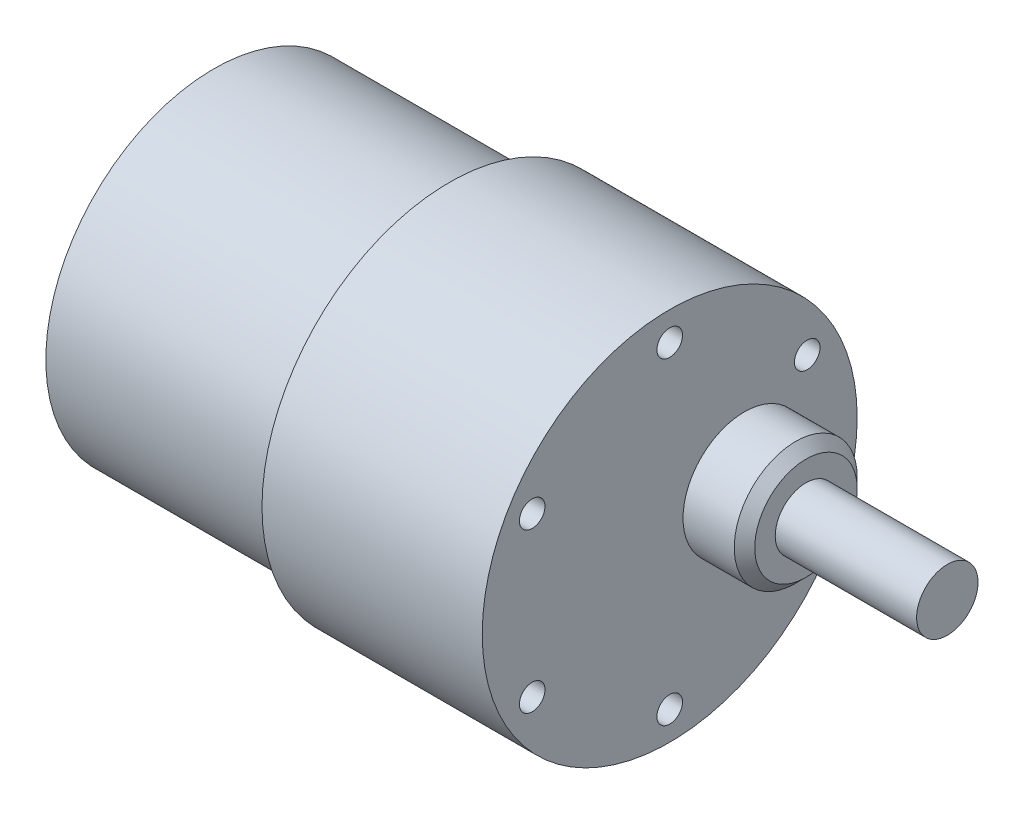
from build123d import *

# Parameters (mm, degrees)
SKETCH_1_R               = 16.4
EXTRUDE_1_DEPTH          = 23
SKETCH_2_R               = 18.3
EXTRUDE_2_DEPTH          = 21.5
SKETCH_3_R               = 6
EXTRUDE_3_DEPTH          = 6
SKETCH_4_R               = 3
EXTRUDE_4_DEPTH          = 13.8
PATTERN_CIRCULAR_1_COUNT = 6
CHAMFER_1_SIZE           = 1


with BuildPart() as part:
    # 草图1 → 凸台-拉伸1 (new body)
    with BuildSketch(Plane(origin=(0, 0, 0), x_dir=(0, 0, -1), z_dir=(1, 0, 0))):
        Circle(SKETCH_1_R)
    extrude(amount=EXTRUDE_1_DEPTH)

    # 草图2 → 凸台-拉伸2 (add)
    with BuildSketch(Plane(origin=(23, 0, 0), x_dir=(0, 0, -1), z_dir=(1, 0, 0))):
        Circle(SKETCH_2_R)
    extrude(amount=EXTRUDE_2_DEPTH)

    # 草图3 → 凸台-拉伸3 (add)
    with BuildSketch(Plane(origin=(44.5, 0, 0), x_dir=(0, 0, -1), z_dir=(1, 0, 0))):
        with Locations((7.3, 0)):
            Circle(SKETCH_3_R)
    extrude(amount=EXTRUDE_3_DEPTH)

    # 草图4 → 凸台-拉伸4 (add)
    with BuildSketch(Plane(origin=(50.5, 0, 0), x_dir=(0, 0, -1), z_dir=(1, 0, 0))):
        with Locations(Location((7.3, 0, 0), (0, 0, 180))):
            Circle(SKETCH_4_R)
    extrude(amount=EXTRUDE_4_DEPTH)

    # 草图7 → M3 螺纹孔1 (revolve, cut)
    with BuildSketch(Plane(origin=(44.5, 15.5, 0), x_dir=(0, 0, -1), z_dir=(0, 1, 0))):
        Polygon((0, 0), (0, 5.751075774), (1.25, 5), (1.25, 0), align=None)
    hole_wizard_m3_1 = revolve(axis=Axis((50.85, 15.5, 0), (-1, 0, 0)), mode=Mode.SUBTRACT)

    # 阵列(圆周)1: M3 螺纹孔1 ×6 about axis
    pattern_circular_1_axis = Axis((0, 0, 0), (1, 0, 0))
    for i in range(1, PATTERN_CIRCULAR_1_COUNT):
        add(hole_wizard_m3_1.rotate(pattern_circular_1_axis, i * 360 / PATTERN_CIRCULAR_1_COUNT), mode=Mode.SUBTRACT)

    # 倒角1
    chamfer_1_edges = [part.edges().sort_by_distance(p)[0] for p in [
        (50.5, 0, -1.3),
    ]]
    chamfer(chamfer_1_edges, length=CHAMFER_1_SIZE)


solid = part.part
